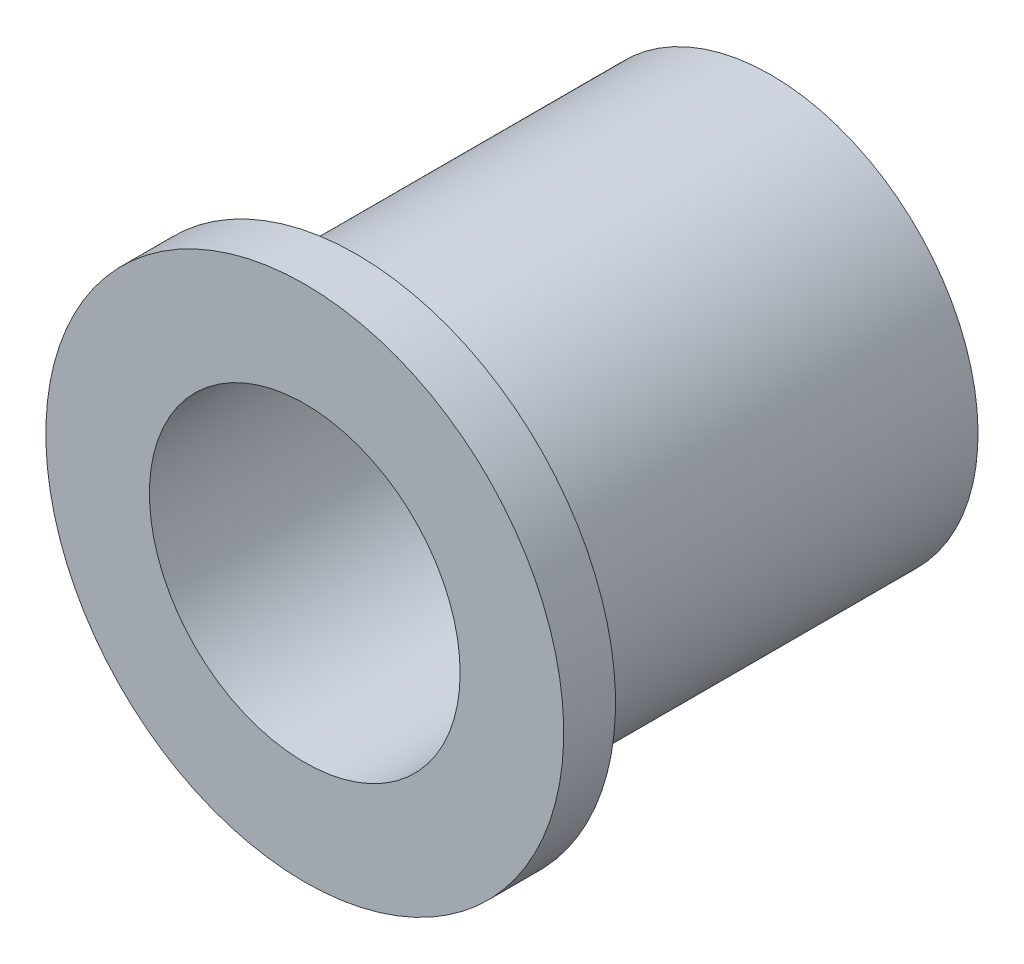
from build123d import *

# Parameters (mm, degrees)
SKETCH2_R          = 15
CUT_EXTRUDE1_DEPTH = 69.373971656


with BuildPart() as part:
    # Sketch1 → Revolve1 (revolve)
    with BuildSketch(Plane(origin=(0, 0, 0), x_dir=(0, 0, -1), z_dir=(1, 0, 0)), mode=Mode.PRIVATE) as revolve1_sk:
        Polygon((23.170638754, 0), (-16.829361246, 0), (-16.829361246, -5), (-21.829361246, -5), (-21.829361246, 20), (23.170638754, 20), align=None)
    revolve(revolve1_sk.sketch.rotate(Axis((0, 20, 21.829361246), (0, 0, -1)), 180), axis=Axis((0, 20, 21.829361246), (0, 0, -1)))

    # Sketch2 → Cut-Extrude1 (cut, through all)
    with BuildSketch(Plane.XY.offset(21.829361246)):
        with Locations((0, 20)):
            Circle(SKETCH2_R)
    extrude(amount=-CUT_EXTRUDE1_DEPTH, mode=Mode.SUBTRACT)


solid = part.part
